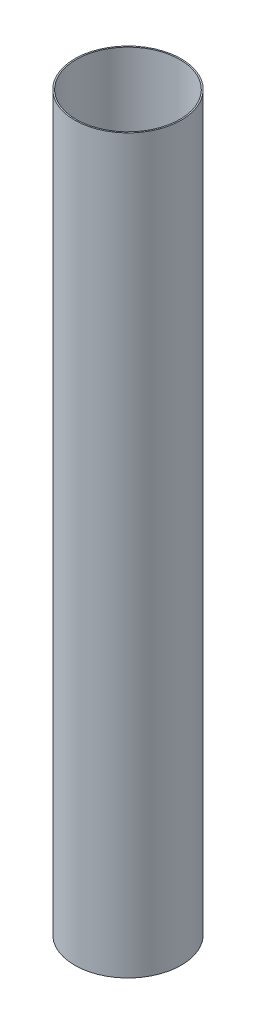
from build123d import *

# Parameters (mm, degrees)
SKETCH2_R   = 40
SKETCH2_R_2 = 39
BODY_DEPTH  = 550


with BuildPart() as part:
    # Sketch2 → body (new body)
    with BuildSketch(Plane(origin=(0, 0, 0), x_dir=(1, 0, 0), z_dir=(0, 1, 0))):
        with Locations(Location((0, 0, 0), (0, 0, 270))):
            Circle(SKETCH2_R)
        with Locations(Location((0, 0, 0), (0, 0, 270))):
            Circle(SKETCH2_R_2, mode=Mode.SUBTRACT)
    extrude(amount=BODY_DEPTH)


solid = part.part
